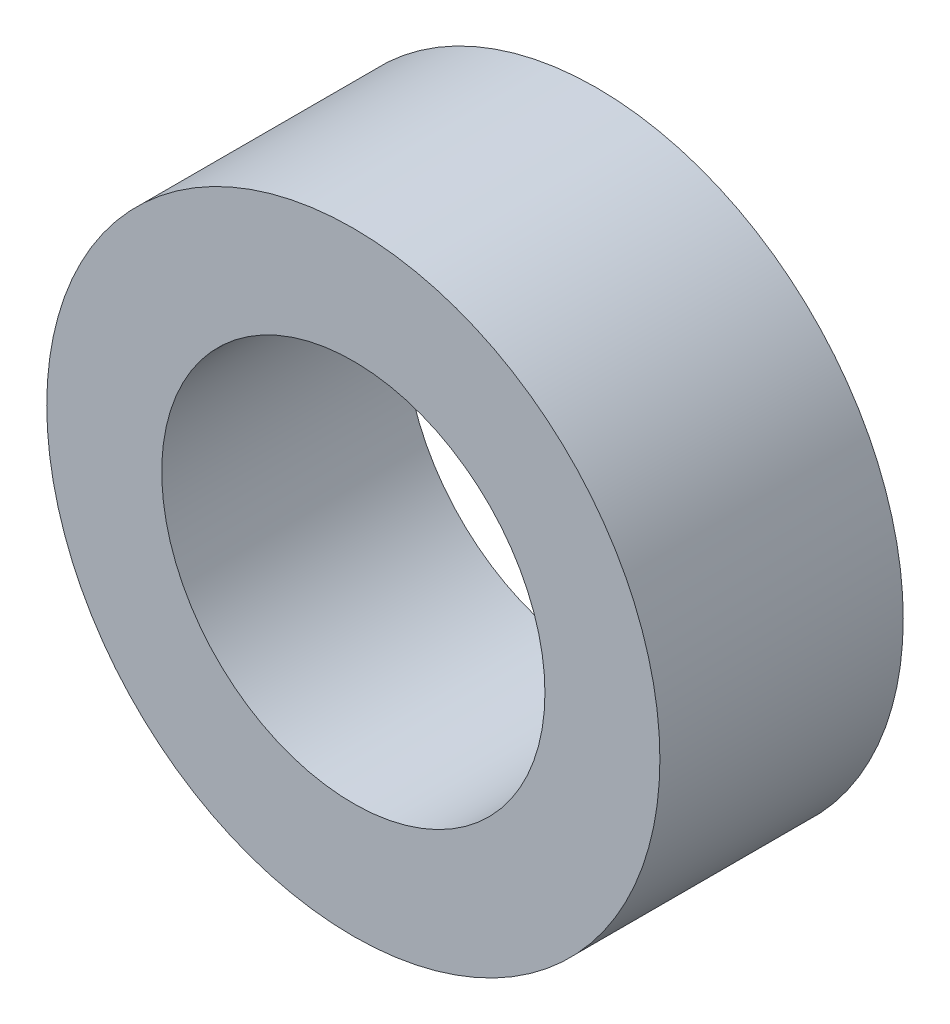
from build123d import *

# Parameters (mm, degrees)
SKETCH1_R           = 4
BOSS_EXTRUDE1_DEPTH = 3.175
SKETCH2_R           = 2.5
CUT_EXTRUDE1_DEPTH  = 7.48695807


with BuildPart() as part:
    # Sketch1 → Boss-Extrude1 (new body)
    with BuildSketch(Plane.XY):
        Circle(SKETCH1_R)
    extrude(amount=BOSS_EXTRUDE1_DEPTH)

    # Sketch2 → Cut-Extrude1 (cut, through all)
    with BuildSketch(Plane.XY.offset(3.175)):
        Circle(SKETCH2_R)
    extrude(amount=-CUT_EXTRUDE1_DEPTH, mode=Mode.SUBTRACT)


solid = part.part
